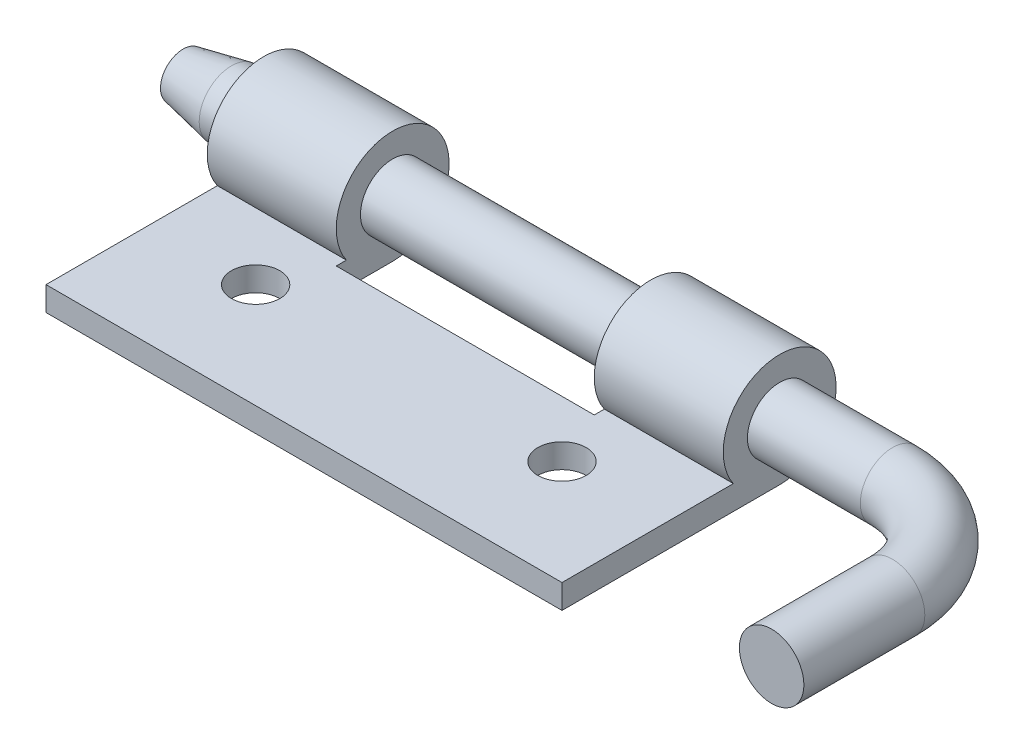
from build123d import *

# Parameters (mm, degrees)
SKETCH_6_R      = 3.5
EXTRUDE_4_DEPTH = 8
EXTRUDE_START   = -24
SKETCH_7_R      = 3.5
EXTRUDE_5_DEPTH = 8
EXTRUDE_START_2 = -3.5
SKETCH_8_R      = 1.5
EXTRUDE_6_DEPTH = 1.5
SKETCH_10_R     = 2


with BuildPart() as part:
    # 草图6 → 凸台-拉伸4 (new body)
    with BuildSketch(Plane(origin=(0, 0, 0), x_dir=(0, 0, -1), z_dir=(1, 0, 0))):
        Circle(SKETCH_6_R)
    extrude(amount=EXTRUDE_4_DEPTH)



with BuildPart() as body_2:
    # 草图7 → 凸台-拉伸5 (new body)
    with BuildSketch(Plane.ZY.offset(EXTRUDE_START)):
        with Locations(Location((0, 0, 0), (0, 0, 180))):
            Circle(SKETCH_7_R)
    extrude(amount=-EXTRUDE_5_DEPTH)


with BuildPart() as part_1:
    add(part.part)

    add(body_2.part)  # 凸台-拉伸6 merges body 2
    # 草图8 → 凸台-拉伸6 (add)
    with BuildSketch(Plane(origin=(0, 0, 0), x_dir=(1, 0, 0), z_dir=(0, 1, 0)).offset(EXTRUDE_START_2)):
        Polygon((0, 0), (8, 0), (8, -3.5), (24, -3.5), (24, 0), (32, 0), (32, -13.5), (0, -13.5), align=None)
        with Locations(Location((25.5, -7, 0), (0, 0, 270))):
            Circle(SKETCH_8_R, mode=Mode.SUBTRACT)
        with Locations(Location((6.5, -7, 0), (0, 0, 270))):
            Circle(SKETCH_8_R, mode=Mode.SUBTRACT)
    extrude(amount=EXTRUDE_6_DEPTH)

    # 扫描1: sweep along a path in 草图9
    with BuildLine(Plane(origin=(0, 0, 0), x_dir=(1, 0, 0), z_dir=(0, 1, 0))) as sweep_1_path:
        Line((-5, 0), (39, 0))
        ThreePointArc((39, 0), (43.242640687, -1.757359313), (45, -6))
        Line((45, -6), (45, -13.5))
    # 草图10 → 扫描1 (sweep)
    with BuildSketch(Plane(origin=(-5, 0, 0), x_dir=(0, 0, -1), z_dir=(1, 0, 0))):
        Circle(SKETCH_10_R)
    sweep(path=sweep_1_path.line)

    # 草图11 → 切除-旋转1 (revolve, cut)
    with BuildSketch(Plane(origin=(0, 0, 0), x_dir=(1, 0, 0), z_dir=(0, 1, 0))):
        Polygon((-2, 2), (-5, 2), (-5, 1.4), align=None)
    revolve(axis=Axis((-14.922922677, 0, 0), (1, 0, 0)), mode=Mode.SUBTRACT)


solid = part_1.part
